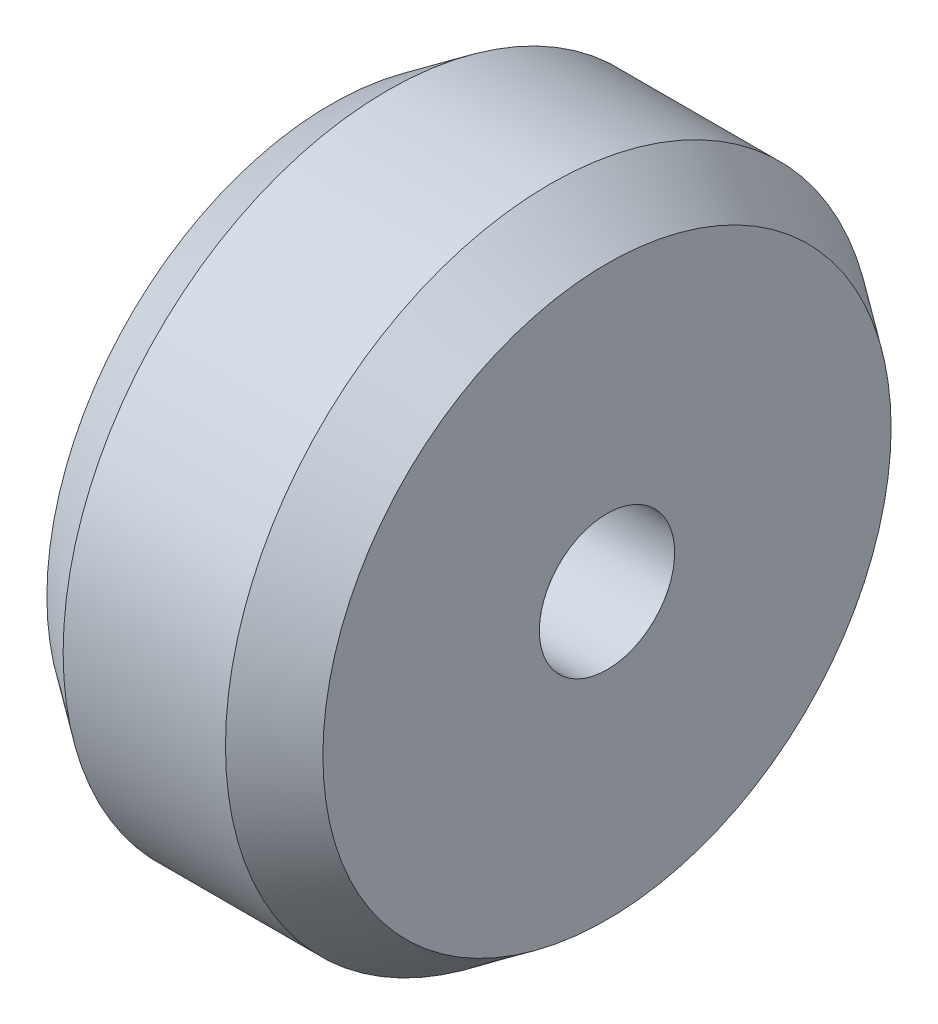
from build123d import *


with BuildPart() as part:
    # Croquis1 → Revolución1 (revolve)
    with BuildSketch(Plane.XY, mode=Mode.PRIVATE) as revoluci_n1_sk:
        Polygon((5.1, 2.5), (-5.1, 2.5), (-5.1, 10.5), (-3, 12), (3, 12), (5.1, 10.5), align=None)
    revolve(revoluci_n1_sk.sketch.rotate(Axis((-46.209429442, 0, 0), (1, 0, 0)), 90), axis=Axis((-46.209429442, 0, 0), (1, 0, 0)))


solid = part.part
